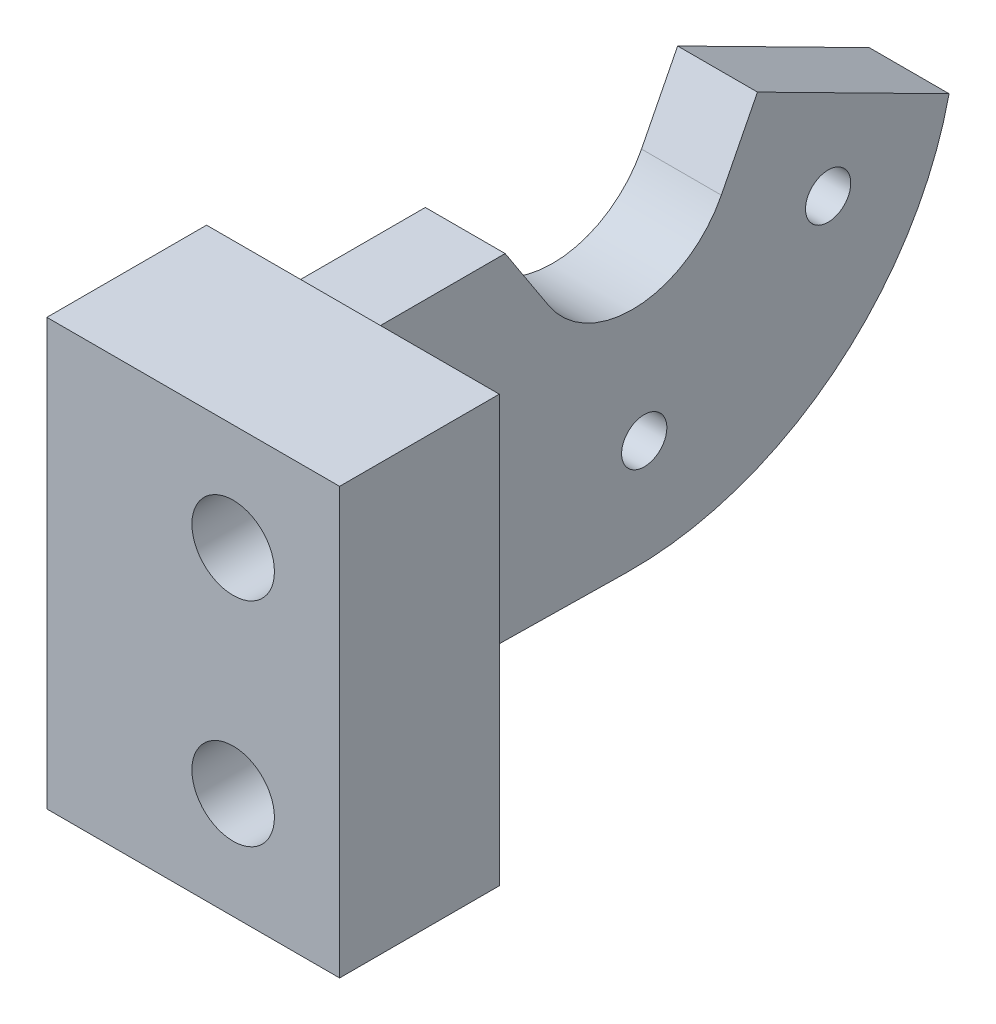
from build123d import *

# Parameters (mm, degrees)
SKETCH1_W           = 8
SKETCH1_H           = 16
SKETCH1_R           = 1.55
BOSS_EXTRUDE1_DEPTH = 6
CUT_EXTRUDE1_DEPTH  = 2.5
SKETCH3_W           = 6
SKETCH3_H           = 16
SKETCH3_R           = 0.85
BOSS_EXTRUDE2_DEPTH = 3


with BuildPart() as part:
    # Sketch1 → Boss-Extrude1 (new body)
    with BuildSketch(Plane.XY):
        with Locations((4, 8)):
            Rectangle(SKETCH1_W, SKETCH1_H)
        with Locations((4, 12)):
            Circle(SKETCH1_R, mode=Mode.SUBTRACT)
        with Locations((4, 4)):
            Circle(SKETCH1_R, mode=Mode.SUBTRACT)
    extrude(amount=BOSS_EXTRUDE1_DEPTH)

    # Sketch2 → Cut-Extrude1 (cut)
    with BuildSketch(Plane(origin=(0, 0, 0), x_dir=(-1, 0, 0), z_dir=(0, 0, -1))):
        Polygon((-0.766838493, 12), (-2.383419246, 14.8), (-5.616580754, 14.8), (-7.233161507, 12), (-5.616580754, 9.2), (-2.383419246, 9.2), align=None)
        Polygon((-0.766838493, 4), (-2.383419246, 6.8), (-5.616580754, 6.8), (-7.233161507, 4), (-5.616580754, 1.2), (-2.383419246, 1.2), align=None)
    extrude(amount=-CUT_EXTRUDE1_DEPTH, mode=Mode.SUBTRACT)

    # Sketch3 → Boss-Extrude2 (add)
    # profile 1 of 2: a face of its own
    with BuildSketch(Plane.ZY):
        with Locations((3, 8)):
            Rectangle(SKETCH3_W, SKETCH3_H)
    # profile 2 of 2: a face of its own
    with BuildSketch(Plane.ZY):
        with BuildLine():
            Line((-16.344198667, 10.303286919), (-17.701569131, 12.978645853))
            Line((-17.701569131, 12.978645853), (-24.903097097, 9.324877666))
            ThreePointArc((-24.903097097, 9.324877666), (-20.548417458, 2.41556502), (-12.810955614, -0.198535249))
            Line((-12.810955614, -0.198535249), (0, 0))
            Line((0, 0), (0, 12.465392311))
            Line((0, 12.465392311), (-8.220260468, 12.465392311))
            Line((-8.220260468, 12.465392311), (-9.858504036, 9.95219554))
            ThreePointArc((-9.858504036, 9.95219554), (-13.202702703, 8.255482459), (-16.344198667, 10.303286919))
        make_face()
        with Locations((-13.445945946, 3.76206141)):
            Circle(SKETCH3_R, mode=Mode.SUBTRACT)
        with Locations((-6.088708879, 7.494830187)):
            Circle(SKETCH3_R, mode=Mode.SUBTRACT)
        with Locations((-20.357237067, 8.267231223)):
            Circle(SKETCH3_R, mode=Mode.SUBTRACT)
    extrude(amount=BOSS_EXTRUDE2_DEPTH)


solid = part.part
